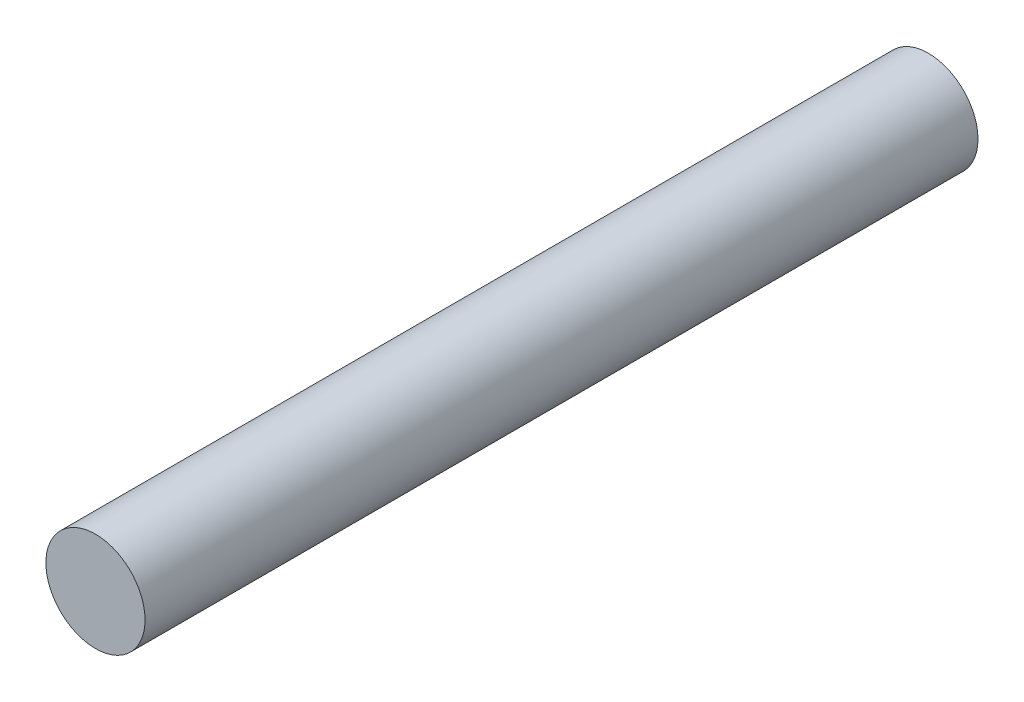
from build123d import *

# Parameters (mm, degrees)
SKETCH1_R           = 1.5
BOSS_EXTRUDE1_DEPTH = 25.2


with BuildPart() as part:
    # Sketch1 → Boss-Extrude1 (new body)
    with BuildSketch(Plane.XY):
        Circle(SKETCH1_R)
    extrude(amount=BOSS_EXTRUDE1_DEPTH)


solid = part.part
